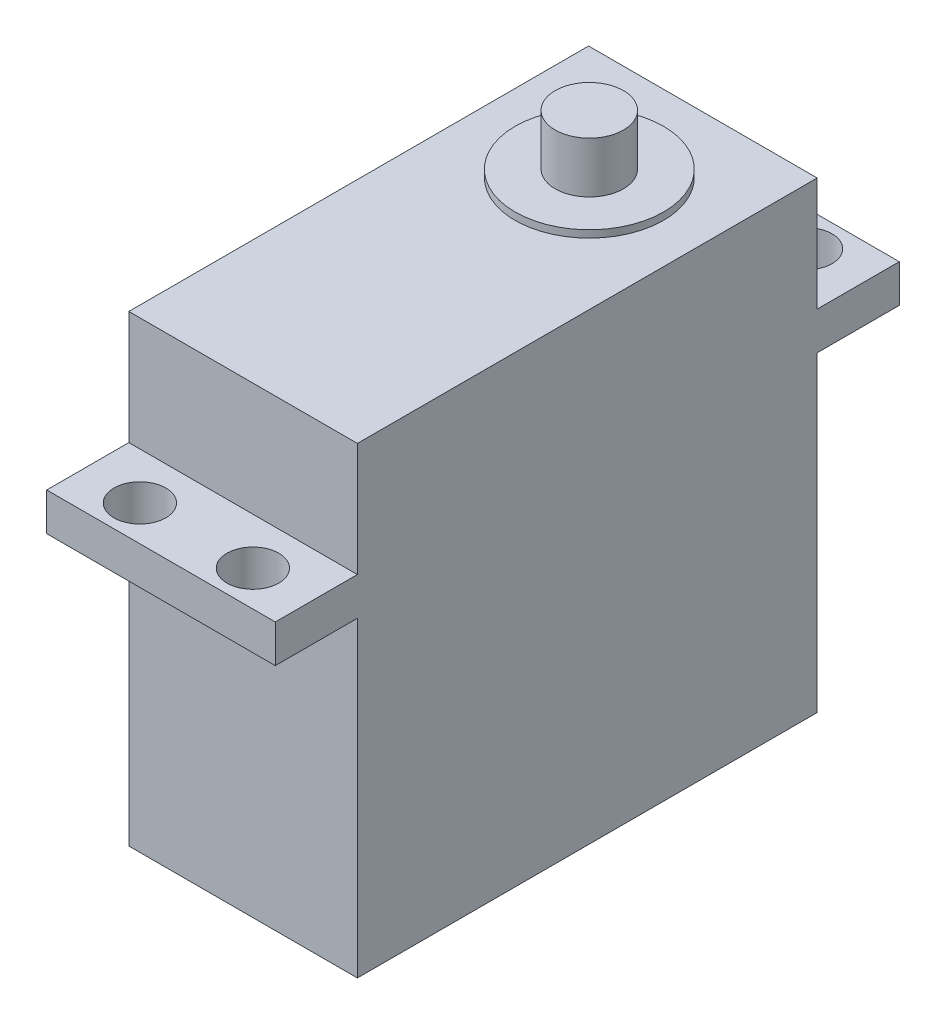
from build123d import *

# Parameters (mm, degrees)
BOSS_EXTRUDE1_DEPTH = 19.939
SKETCH2_R           = 2.97815
BOSS_EXTRUDE2_DEPTH = 5.08
SKETCH3_R           = 6.477
BOSS_EXTRUDE3_DEPTH = 0.635
SKETCH4_R           = 2.2606
CUT_EXTRUDE1_DEPTH  = 60.674033694


with BuildPart() as part:
    # Sketch1 → Boss-Extrude1 (new body)
    with BuildSketch(Plane(origin=(0, 0, 0), x_dir=(0, 0, -1), z_dir=(1, 0, 0))):
        Polygon((0, 0), (40.1066, 0), (40.1066, 27.178), (47.2694, 27.178), (47.2694, 30.48), (40.1066, 30.48), (40.1066, 40.386), (0, 40.386), (0, 30.48), (-7.1628, 30.48), (-7.1628, 27.178), (0, 27.178), align=None)
    extrude(amount=BOSS_EXTRUDE1_DEPTH)

    # Sketch2 → Boss-Extrude2 (add)
    with BuildSketch(Plane(origin=(0, 40.386, 0), x_dir=(1, 0, 0), z_dir=(0, 1, 0))):
        with Locations((9.9695, 30.2006)):
            Circle(SKETCH2_R)
    extrude(amount=BOSS_EXTRUDE2_DEPTH)

    # Sketch3 → Boss-Extrude3 (add)
    with BuildSketch(Plane(origin=(0, 40.386, 0), x_dir=(1, 0, 0), z_dir=(0, 1, 0))):
        with Locations((9.9695, 30.2006)):
            Circle(SKETCH3_R)
    extrude(amount=BOSS_EXTRUDE3_DEPTH)

    # Sketch4 → Cut-Extrude1 (cut, through all)
    with BuildSketch(Plane(origin=(0, 30.48, 0), x_dir=(1, 0, 0), z_dir=(0, 1, 0))):
        with Locations((5.0419, 44.1833)):
            Circle(SKETCH4_R)
        with Locations((14.8971, 44.1833)):
            Circle(SKETCH4_R)
        with Locations((14.8971, -4.0767)):
            Circle(SKETCH4_R)
        with Locations((5.0419, -4.0767)):
            Circle(SKETCH4_R)
    extrude(amount=-CUT_EXTRUDE1_DEPTH, mode=Mode.SUBTRACT)


solid = part.part
